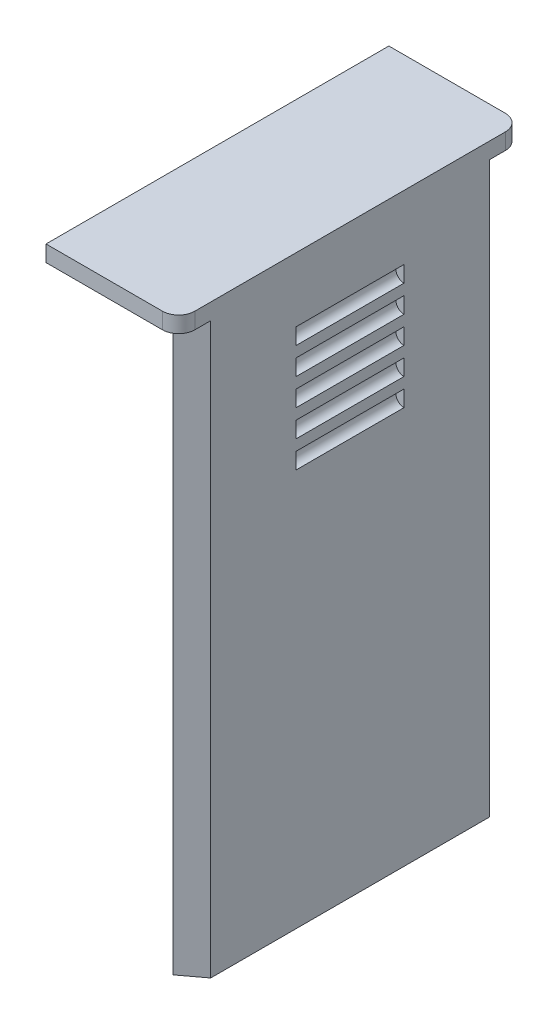
from build123d import *

# Parameters (mm, degrees)
CROQUIS1_W              = 12.3
CROQUIS1_H              = 31.8
SALIENTE_EXTRUIR1_DEPTH = 1.5
SALIENTE_EXTRUIR2_DEPTH = 52.8
CROQUIS5_W              = 1
CROQUIS5_H              = 15
SALIENTE_EXTRUIR4_DEPTH = 20
CROQUIS4_R              = 0.75
CORTAR_EXTRUIR1_DEPTH   = 5
REDONDEO1_R             = 1.5


with BuildPart() as part:
    # Croquis1 → Saliente-Extruir1 (new body)
    with BuildSketch(Plane(origin=(0, 111.467949425, 0), x_dir=(1, 0, 0), z_dir=(0, 1, 0))):
        with Locations((-9.802229413, -88.318391236)):
            Rectangle(CROQUIS1_W, CROQUIS1_H)
    extrude(amount=-SALIENTE_EXTRUIR1_DEPTH)

    # Croquis2 → Saliente-Extruir2 (add)
    with BuildSketch(Plane.XZ.offset(-109.967949425)):
        Polygon((-3.652229413, 101.243391236), (-5.652229413, 102.743391236), (-5.652229413, 73.893391236), (-3.652229413, 75.393391236), align=None)
    extrude(amount=SALIENTE_EXTRUIR2_DEPTH)

    # Croquis5 → Saliente-Extruir4 (add)
    with BuildSketch(Plane.XZ.offset(-109.967949425)):
        with Locations((-6.152229413, 88.318391236)):
            Rectangle(CROQUIS5_W, CROQUIS5_H)
    extrude(amount=SALIENTE_EXTRUIR4_DEPTH)

    # Croquis4 → Cortar-Extruir1 (cut, symmetric)
    with BuildSketch(Plane(origin=(0, 0, 88.318391236), x_dir=(0, -1, 0), z_dir=(0, 0, 1))):
        with Locations((-104.767949425, -3.652229413)):
            Circle(CROQUIS4_R)
        with Locations((-102.267949425, -3.652229413)):
            Circle(CROQUIS4_R)
        with Locations((-99.767949425, -3.652229413)):
            Circle(CROQUIS4_R)
        with Locations((-97.267949425, -3.652229413)):
            Circle(CROQUIS4_R)
        with Locations((-94.767949425, -3.652229413)):
            Circle(CROQUIS4_R)
    extrude(amount=CORTAR_EXTRUIR1_DEPTH, both=True, mode=Mode.SUBTRACT)

    # Redondeo1
    redondeo1_edges = [part.edges().sort_by_distance(p)[0] for p in [
        (-3.652229413, 110.717949425, 72.418391236),
        (-3.652229413, 110.717949425, 104.218391236),
    ]]
    fillet(redondeo1_edges, radius=REDONDEO1_R)


solid = part.part
